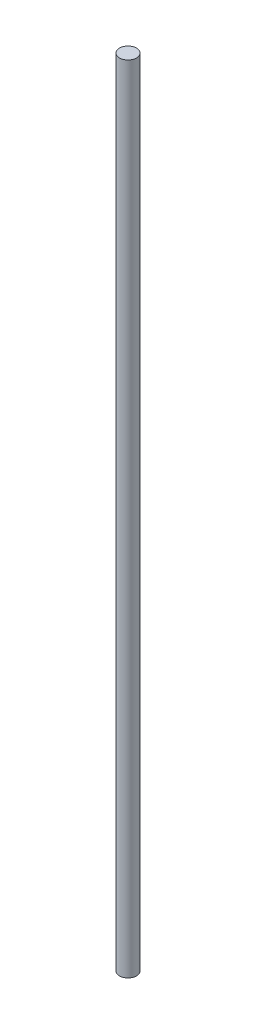
from build123d import *

# Parameters (mm, degrees)
SKETCH1_R           = 1.5
BOSS_EXTRUDE1_DEPTH = 139


with BuildPart() as part:
    # Sketch1 → Boss-Extrude1 (new body)
    with BuildSketch(Plane(origin=(0, 0, 0), x_dir=(1, 0, 0), z_dir=(0, 1, 0))):
        with Locations(Location((0, 0, 0), (0, 0, 270))):
            Circle(SKETCH1_R)
    extrude(amount=BOSS_EXTRUDE1_DEPTH)


solid = part.part
